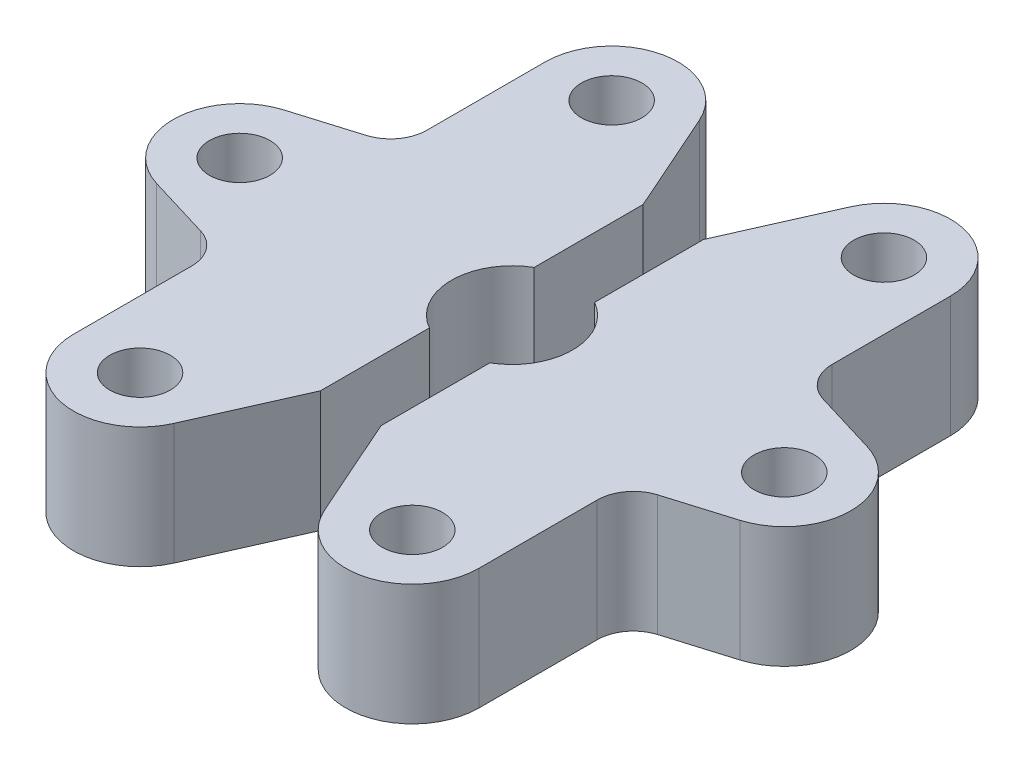
from build123d import *

# Parameters (mm, degrees)
SKETCH1_R             = 2.5
BOSS_EXTRUDE1_DEPTH   = 10
BOSS_EXTRUDE1_2_DEPTH = 10
FILLET1_R             = 3
FILLET2_R             = 3


with BuildPart() as part:
    # Sketch1 → Boss-Extrude1 (new body)
    with BuildSketch(Plane(origin=(0, 0, 0), x_dir=(1, 0, 0), z_dir=(0, 1, 0))):
        with BuildLine():
            Line((-2.5, 13.330127019), (-6.223036191, 21.717081134))
            ThreePointArc((-6.223036191, 21.717081134), (-12.390547906, 24.866013061), (-16.75, 19.485571585))
            Line((-16.75, 19.485571585), (-16.75, 7.485571585))
            Line((-16.75, 7.485571585), (-24.092524197, 5.264396137))
            ThreePointArc((-24.092524197, 5.264396137), (-28, 0), (-24.092524197, -5.264396137))
            Line((-24.092524197, -5.264396137), (-16.75, -7.485571585))
            Line((-16.75, -7.485571585), (-16.75, -19.485571585))
            ThreePointArc((-16.75, -19.485571585), (-12.390547906, -24.866013061), (-6.223036191, -21.717081134))
            Line((-6.223036191, -21.717081134), (-2.5, -13.330127019))
            Line((-2.5, -13.330127019), (-2.5, -4.330127019))
            ThreePointArc((-2.5, -4.330127019), (-5, 0), (-2.5, 4.330127019))
            Line((-2.5, 4.330127019), (-2.5, 13.330127019))
        make_face()
        with Locations((-11.25, 19.485571585)):
            Circle(SKETCH1_R, mode=Mode.SUBTRACT)
        with Locations((-11.25, -19.485571585)):
            Circle(SKETCH1_R, mode=Mode.SUBTRACT)
        with Locations((-22.5, 0)):
            Circle(SKETCH1_R, mode=Mode.SUBTRACT)
    extrude(amount=BOSS_EXTRUDE1_DEPTH)

    # Fillet1
    fillet1_edges = [part.edges().sort_by_distance(p)[0] for p in [
        (-16.75, 5, 7.485571585),
        (-16.75, 5, -7.485571585),
    ]]
    fillet(fillet1_edges, radius=FILLET1_R)


with BuildPart() as body_2:
    # Sketch1 → Boss-Extrude1 2 (new body)
    with BuildSketch(Plane(origin=(0, 0, 0), x_dir=(1, 0, 0), z_dir=(0, 1, 0))):
        with BuildLine():
            Line((2.5, 13.330127019), (2.5, 4.330127019))
            ThreePointArc((2.5, 4.330127019), (5, 0), (2.5, -4.330127019))
            Line((2.5, -4.330127019), (2.5, -13.330127019))
            Line((2.5, -13.330127019), (6.223036191, -21.717081134))
            ThreePointArc((6.223036191, -21.717081134), (12.390547906, -24.866013061), (16.75, -19.485571585))
            Line((16.75, -19.485571585), (16.75, -7.485571585))
            Line((16.75, -7.485571585), (24.092524197, -5.264396137))
            ThreePointArc((24.092524197, -5.264396137), (28, 0), (24.092524197, 5.264396137))
            Line((24.092524197, 5.264396137), (16.75, 7.485571585))
            Line((16.75, 7.485571585), (16.75, 19.485571585))
            ThreePointArc((16.75, 19.485571585), (12.390547906, 24.866013061), (6.223036191, 21.717081134))
            Line((6.223036191, 21.717081134), (2.5, 13.330127019))
        make_face()
        with Locations((11.25, 19.485571585)):
            Circle(SKETCH1_R, mode=Mode.SUBTRACT)
        with Locations((11.25, -19.485571585)):
            Circle(SKETCH1_R, mode=Mode.SUBTRACT)
        with Locations((22.5, 0)):
            Circle(SKETCH1_R, mode=Mode.SUBTRACT)
    extrude(amount=BOSS_EXTRUDE1_2_DEPTH)

    # Fillet2
    fillet2_edges = [body_2.edges().sort_by_distance(p)[0] for p in [
        (16.75, 5, 7.485571585),
        (16.75, 5, -7.485571585),
    ]]
    fillet(fillet2_edges, radius=FILLET2_R)


solid = Compound([part.part, body_2.part])
